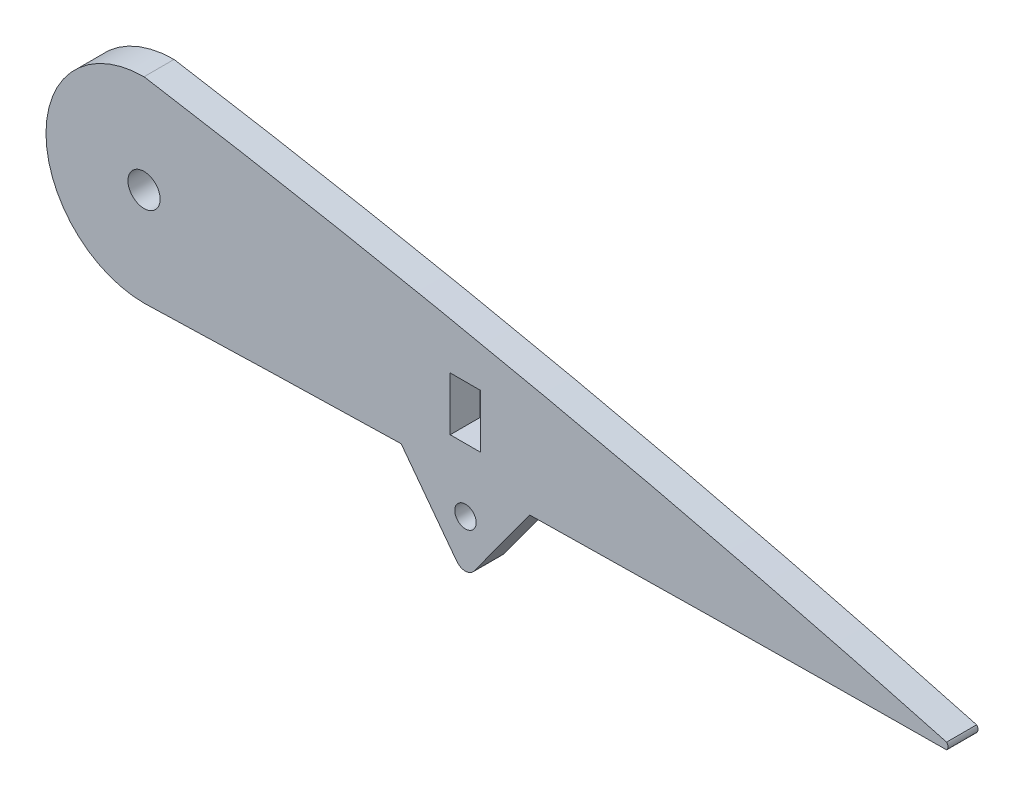
from build123d import *

# Parameters (mm, degrees)
SKETCH_1_R      = 1
SKETCH_1_R_2    = 1.5
SKETCH_1_W      = 2.85
SKETCH_1_H      = 5
EXTRUDE_1_DEPTH = 1.4


with BuildPart() as part:
    # Эскиз1 → Бобышка-Вытянуть1 (new, symmetric)
    with BuildSketch(Plane.XY):
        with BuildLine():
            ThreePointArc((175.091334091, 16.644787515), (168.620686799, 13.96455765), (165.940456932, 7.493910359))
            ThreePointArc((165.940456932, 7.493910359), (168.620686797, 1.023263065), (175.091334091, -1.656966802))
            add(Edge.make_bspline(
                [(175.091334091, -1.656966802), (177.330680613, -1.588466601), (181.854695323, -1.455127256), (188.663234462, -1.270383377), (194.423908611, -1.128102082), (197.899847219, -1.04871935), (199.091334091, -1.02226769)],
                knots=[0.704401069, 0.704401069, 0.704401069, 0.704401069, 0.730918775, 0.757971338, 0.785017763, 0.79912389, 0.79912389, 0.79912389, 0.79912389], degree=3))
            Line((199.091334091, -1.02226769), (204.279973699, -7.926463493))
            ThreePointArc((204.279973699, -7.926463493), (205.086497755, -8.325660965), (205.887265796, -7.915039218))
            Line((205.887265796, -7.915039218), (211.091334091, -0.78138581))
            add(Edge.make_bspline(
                [(211.091334091, -0.78138581), (215.029550732, -0.71061193), (221.226120504, -0.611852577), (229.617630172, -0.50292618), (236.087353854, -0.431514192), (241.980776913, -0.376520461), (246.558970011, -0.339535886), (249.120490965, -0.321271242), (250, -0.315)],
                knots=[0.846478182, 0.846478182, 0.846478182, 0.846478182, 0.893099152, 0.919831065, 0.945809917, 0.969680601, 0.989589706, 1, 1, 1, 1], degree=3))
            ThreePointArc((250, -0.315), (250.130477272, 0), (250, 0.315))
            add(Edge.make_bspline(
                [(250, 0.315), (249.15566774, 0.545019818), (246.720175698, 1.208516243), (242.391332083, 2.358339053), (236.849761204, 3.787625364), (230.779918279, 5.298008837), (224.455917947, 6.812866028), (218.030543496, 8.291610632), (211.562405045, 9.719735057), (205.072411509, 11.092374932), (198.567970913, 12.407850726), (192.052369914, 13.665297924), (185.527619973, 14.864093303), (179.872800983, 15.850364437), (176.392239334, 16.431323122), (175.091334091, 16.644787515)],
                knots=[0, 0, 0, 0, 0.0101622, 0.029313053, 0.052011605, 0.076619468, 0.101948061, 0.127526132, 0.153184131, 0.178867888, 0.204557903, 0.230245712, 0.255925967, 0.281594302, 0.296903142, 0.296903142, 0.296903142, 0.296903142], degree=3))
        make_face()
        with Locations((205.091334091, -3.906089643)):
            Circle(SKETCH_1_R, mode=Mode.SUBTRACT)
        with Locations((175.091334091, 7.493910357)):
            Circle(SKETCH_1_R_2, mode=Mode.SUBTRACT)
        with Locations((205.091334091, 4.493910357)):
            Rectangle(SKETCH_1_W, SKETCH_1_H, mode=Mode.SUBTRACT)
    extrude(amount=EXTRUDE_1_DEPTH, both=True)


solid = part.part
